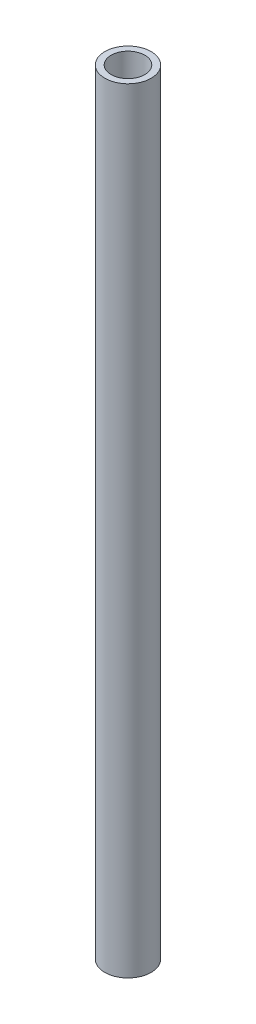
from build123d import *

# Parameters (mm, degrees)
SKETCH1_R           = 16.7005
SKETCH1_R_2         = 12.1539
BOSS_EXTRUDE1_DEPTH = 279.4


with BuildPart() as part:
    # Sketch1 → Boss-Extrude1 (new, symmetric)
    with BuildSketch(Plane(origin=(0, 0, 0), x_dir=(1, 0, 0), z_dir=(0, 1, 0))):
        with Locations(Location((0, 0, 0), (0, 0, 270))):
            Circle(SKETCH1_R)
        with Locations(Location((0, 0, 0), (0, 0, 270))):
            Circle(SKETCH1_R_2, mode=Mode.SUBTRACT)
    extrude(amount=BOSS_EXTRUDE1_DEPTH, both=True)


solid = part.part
